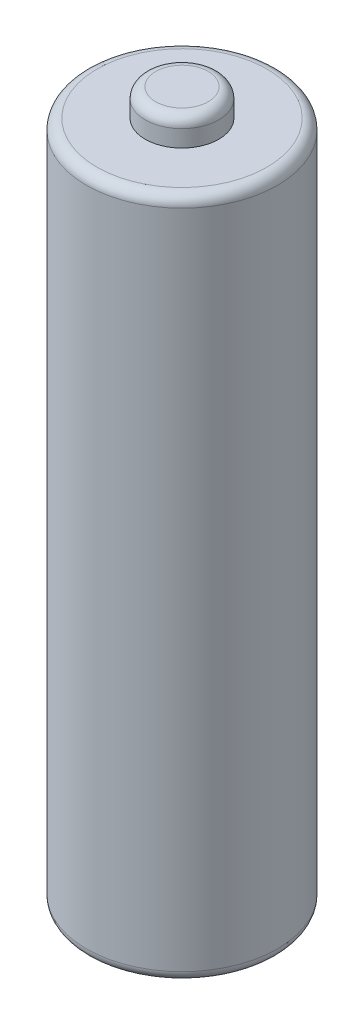
from build123d import *

# Parameters (mm, degrees)
CROQUIS1_R              = 9.1
SALIENTE_EXTRUIR1_DEPTH = 65
CROQUIS2_R              = 3.5
SALIENTE_EXTRUIR2_DEPTH = 2.6
REDONDEO1_R             = 1
REDONDEO2_R             = 1


with BuildPart() as part:
    # Croquis1 → Saliente-Extruir1 (new body)
    with BuildSketch(Plane(origin=(0, 0, 0), x_dir=(1, 0, 0), z_dir=(0, 1, 0))):
        with Locations(Location((0, 0, 0), (0, 0, 270))):
            Circle(CROQUIS1_R)
    extrude(amount=SALIENTE_EXTRUIR1_DEPTH)

    # Croquis2 → Saliente-Extruir2 (add)
    with BuildSketch(Plane(origin=(0, 65, 0), x_dir=(1, 0, 0), z_dir=(0, 1, 0))):
        with Locations(Location((0, 0, 0), (0, 0, 270))):
            Circle(CROQUIS2_R)
    extrude(amount=SALIENTE_EXTRUIR2_DEPTH)

    # Redondeo1
    redondeo1_edges = [part.edges().sort_by_distance(p)[0] for p in [
        (0, 67.6, -3.5),
    ]]
    fillet(redondeo1_edges, radius=REDONDEO1_R)

    # Redondeo2
    redondeo2_edges = [part.edges().sort_by_distance(p)[0] for p in [
        (0, 0, -9.1),
        (0, 65, -9.1),
    ]]
    fillet(redondeo2_edges, radius=REDONDEO2_R)


solid = part.part
